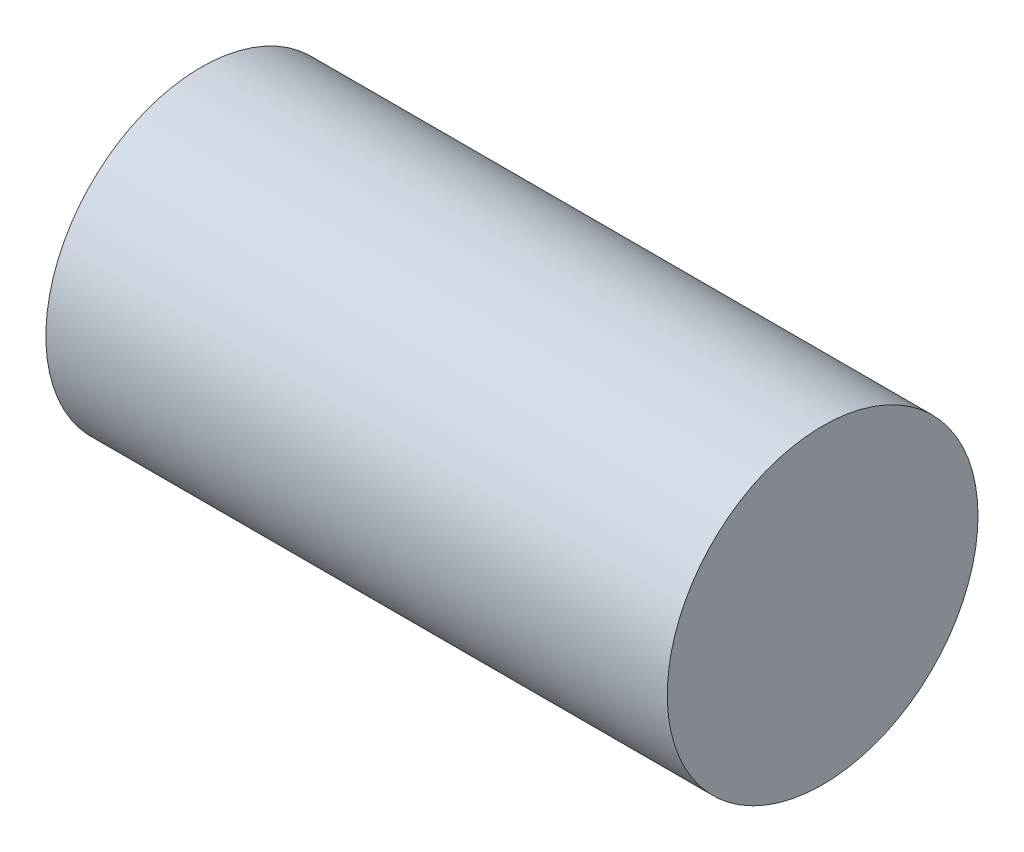
from build123d import *

# Parameters (mm, degrees)
ESQUISSE1_R        = 1
BOSS_EXTRU_1_DEPTH = 4


with BuildPart() as part:
    # Esquisse1 → Boss.-Extru.1 (new body)
    with BuildSketch(Plane(origin=(0, 0, 0), x_dir=(0, 0, -1), z_dir=(1, 0, 0))):
        Circle(ESQUISSE1_R)
    extrude(amount=BOSS_EXTRU_1_DEPTH)


solid = part.part
